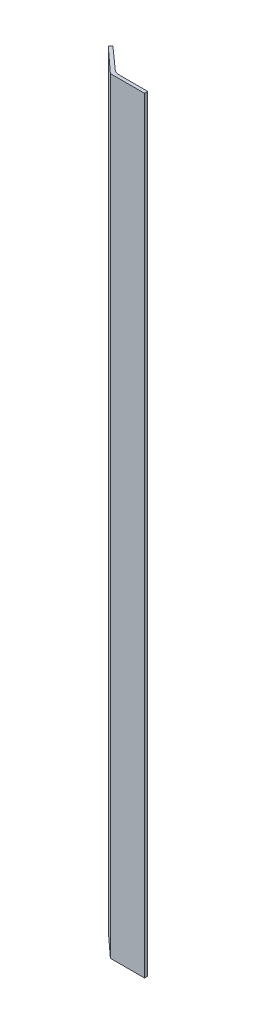
from build123d import *

# Parameters (mm, degrees)
EXTRUDE_START   = 40
EXTRUDE_1_DEPTH = 468.213673317


with BuildPart() as part:
    # Эскиз1 → Вытянуть1 (new body)
    with BuildSketch(Plane(origin=(0, 0, 0), x_dir=(1, 0, 0), z_dir=(0, 1, 0)).offset(EXTRUDE_START)):
        with BuildLine():
            Line((-18.902286518, 12.381871272), (-17.552748119, 13.857928896))
            Line((-17.552748119, 13.857928896), (-3.97119008, 1.754112541))
            ThreePointArc((-3.97119008, 1.754112541), (-2.424474286, 0.81441735), (-0.644564969, 0.48688167))
            Line((-0.644564969, 0.48688167), (17.122829042, 0.48688167))
            Line((17.122829042, 0.48688167), (17.122829042, -1.51311833))
            Line((17.122829042, -1.51311833), (-3.70464164, -1.51311833))
            Line((-3.70464164, -1.51311833), (-18.902286518, 12.381871272))
        make_face()
    extrude(amount=EXTRUDE_1_DEPTH)


solid = part.part
